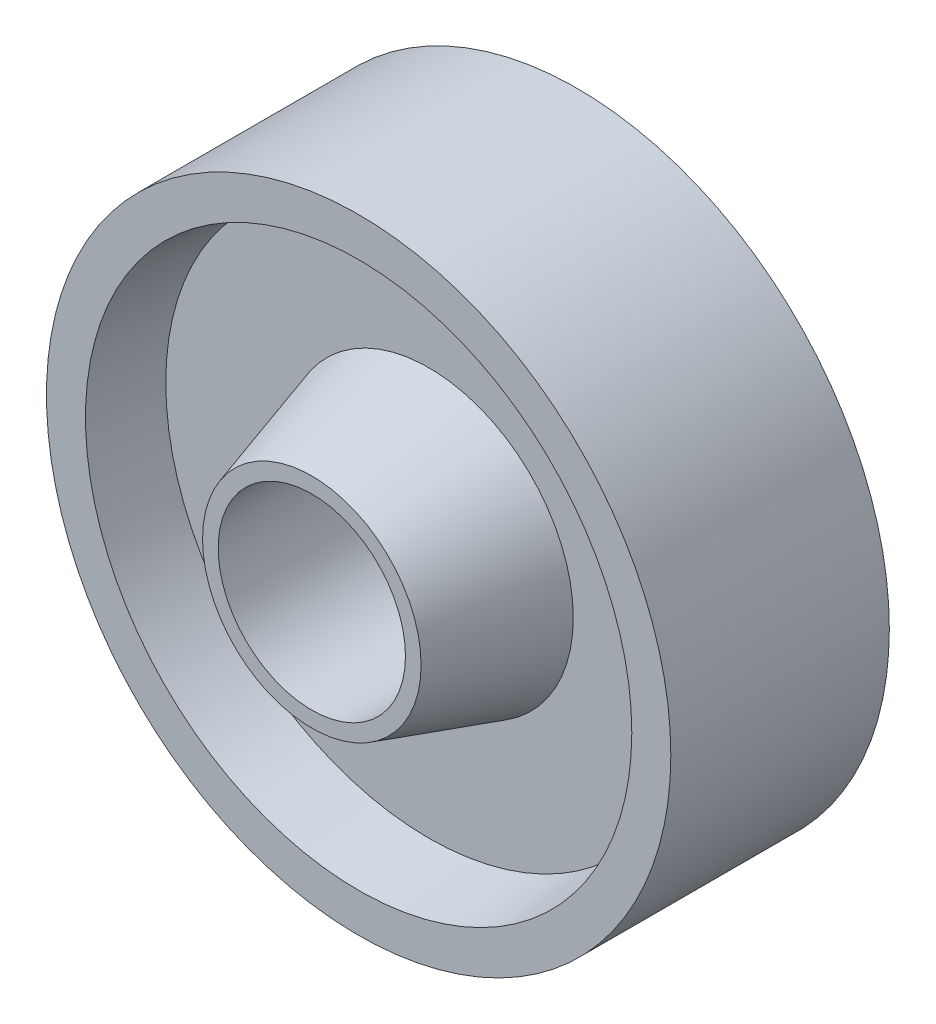
from build123d import *


with BuildPart() as part:
    # Sketch1 → Revolve1 (revolve)
    with BuildSketch(Plane(origin=(0, 0, 0), x_dir=(0, 0, -1), z_dir=(1, 0, 0)), mode=Mode.PRIVATE) as revolve1_sk:
        Polygon((-20, 12), (20, 12), (20, 14), (5, 18.5), (5, 33.714285714), (14, 35), (14, 40), (-14, 40), (-14, 35), (-5, 33.714285714), (-5, 18.5), (-20, 14), align=None)
    revolve(revolve1_sk.sketch.rotate(Axis((0, 0, 0), (0, 0, -1)), 90), axis=Axis((0, 0, 0), (0, 0, -1)))


solid = part.part
